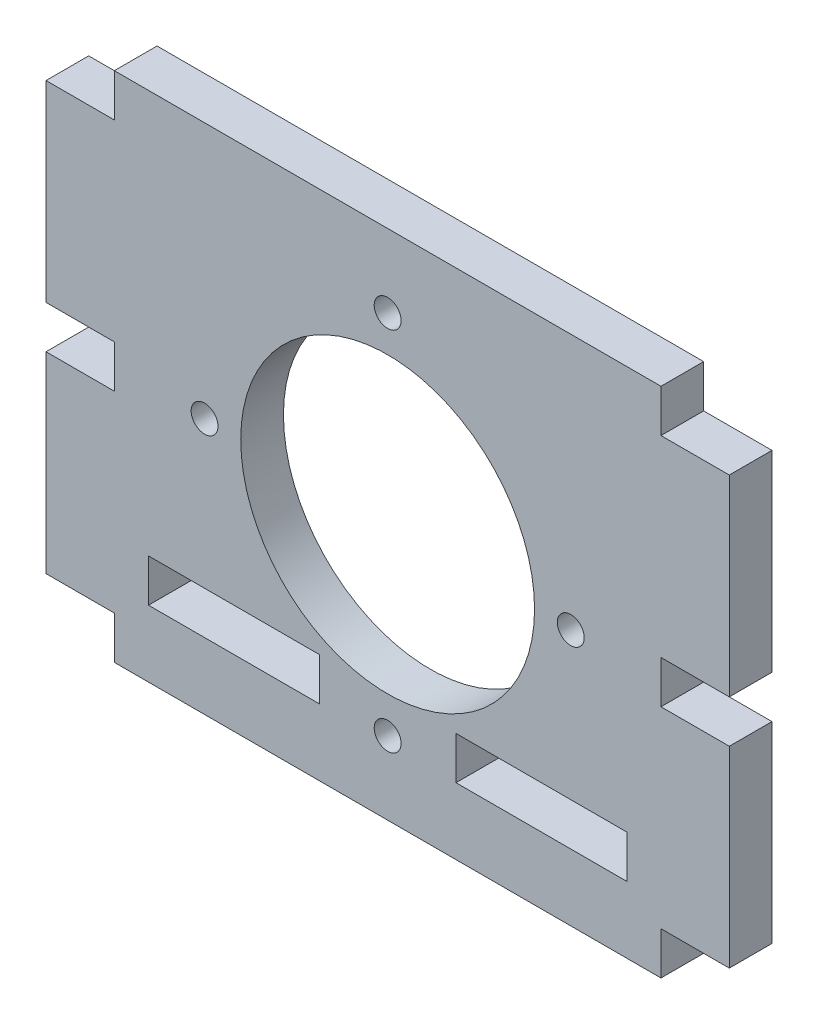
from build123d import *

# Parameters (mm, degrees)
SKETCH3_W           = 12.7
SKETCH3_H           = 3.175
SKETCH3_R           = 0.999998
SKETCH3_R_2         = 10.922
BOSS_EXTRUDE1_DEPTH = 3.175


with BuildPart() as part:
    # Sketch3 → Boss-Extrude1 (new body)
    with BuildSketch(Plane.XY):
        Polygon((-20.32, -15.875), (-20.32, -19.05), (20.32, -19.05), (20.32, -15.875), (25.4, -15.875), (25.4, -1.5875), (20.32, -1.5875), (20.32, 1.5875), (25.4, 1.5875), (25.4, 15.875), (20.32, 15.875), (20.32, 19.05), (-20.32, 19.05), (-20.32, 15.875), (-25.4, 15.875), (-25.4, 1.5875), (-20.32, 1.5875), (-20.32, -1.5875), (-25.4, -1.5875), (-25.4, -15.875), align=None)
        with Locations((-11.43, -12.5095)):
            Rectangle(SKETCH3_W, SKETCH3_H, mode=Mode.SUBTRACT)
        with Locations((0, -13.611800056)):
            Circle(SKETCH3_R, mode=Mode.SUBTRACT)
        with Locations((11.43, -12.5095)):
            Rectangle(SKETCH3_W, SKETCH3_H, mode=Mode.SUBTRACT)
        with Locations((0, -5.6e-08)):
            Circle(SKETCH3_R_2, mode=Mode.SUBTRACT)
        with Locations((-13.611800056, 0)):
            Circle(SKETCH3_R, mode=Mode.SUBTRACT)
        with Locations((13.611800056, 0)):
            Circle(SKETCH3_R, mode=Mode.SUBTRACT)
        with Locations((0, 13.611800056)):
            Circle(SKETCH3_R, mode=Mode.SUBTRACT)
    extrude(amount=BOSS_EXTRUDE1_DEPTH)


solid = part.part
